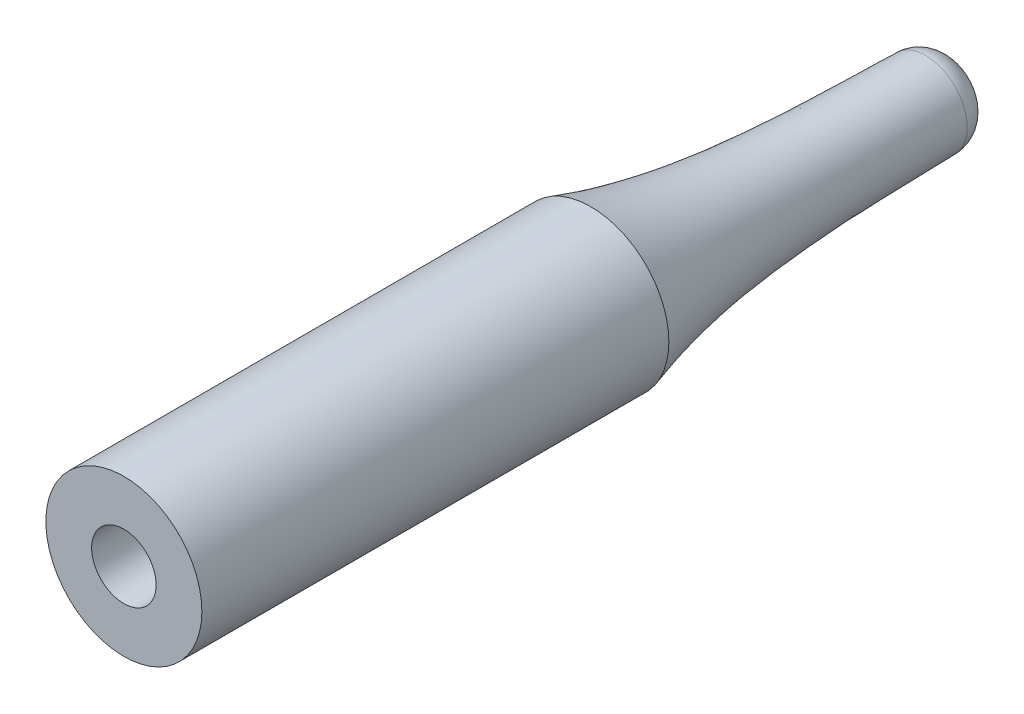
from build123d import *

# Parameters (mm, degrees)
FILLET1_R = 2


with BuildPart() as part:
    # Sketch1 → Revolve1 (revolve)
    with BuildSketch(Plane(origin=(0, 0, 0), x_dir=(1, 0, 0), z_dir=(0, 1, 0))):
        with BuildLine():
            Line((2.971015201, 21.369872107), (0, 21.369872107))
            Line((0, 21.369872107), (0, -31.857927965))
            Line((0, -31.857927965), (2.3495, -31.857927965))
            Line((2.3495, -31.857927965), (2.3495, -38.969927965))
            Line((2.3495, -38.969927965), (5.679999851, -38.969927965))
            Line((5.679999851, -38.969927965), (5.679999851, -4.969927893))
            add(Edge.make_bspline(
                [(2.971015201, 21.369872107), (3.222459796, 12.63958567), (2.971347644, 3.491126919), (5.679999851, -4.969927893)],
                knots=[0, 0, 0, 0, 1, 1, 1, 1], degree=3))
        make_face()
    revolve(axis=Axis((0, 0, -21.369872107), (0, 0, 1)))

    # Fillet1
    fillet1_edges = [part.edges().sort_by_distance(p)[0] for p in [
        (-2.971015201, 0, -21.369872107),
    ]]
    fillet(fillet1_edges, radius=FILLET1_R)


solid = part.part
